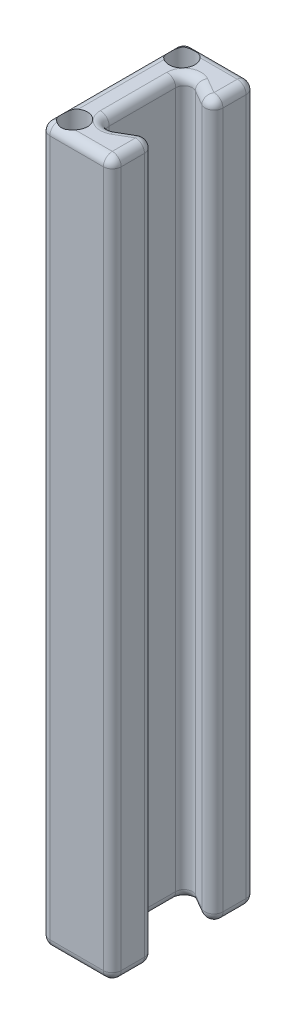
from build123d import *
from OCP.BRepFilletAPI import BRepFilletAPI_MakeFillet

# Parameters (mm, degrees)
BOSS_EXTRUDE2_DEPTH = 127
FILLET1_R1          = 1.5875
FILLET1_R2          = 1.4732
SKETCH2_R           = 2.286
CUT_EXTRUDE1_DEPTH  = 76.2
FILLET3_R           = 1.778


with BuildPart() as part:
    # Sketch1 → Boss-Extrude2 (new body)
    with BuildSketch(Plane(origin=(0, 0, 0), x_dir=(1, 0, 0), z_dir=(0, 1, 0))):
        Polygon((-28.067579909, 0), (-28.067579909, -25.4), (-15.367579909, -25.4), (-15.367579909, -16.933333333), (-22.699928279, -21.166666582), (-22.699928279, -4.233333249), (-15.367579909, -8.466666667), (-15.367579909, 0), align=None)
    extrude(amount=BOSS_EXTRUDE2_DEPTH)

    # Fillet1: one fillet with a radius per group of edges: ONE call of the kernel's fillet builder (fillet() takes one radius for all edges)
    fillet1_edges_1 = [part.edges().sort_by_distance(p)[0] for p in [
        (-19.033754094, 127, 6.349999958),
        (-22.699928279, 127, 12.699999915),
        (-19.033754094, 127, 19.049999958),
        (-15.367579909, 127, 21.166666667),
        (-15.367579909, 127, 4.233333333),
        (-21.717579909, 127, 0),
        (-28.067579909, 63.5, 0),
        (-15.367579909, 63.5, 0),
        (-21.717579909, 0, 0),
        (-15.367579909, 0, 4.233333333),
        (-15.367579909, 63.5, 8.466666667),
        (-15.367579909, 63.5, 16.933333333),
        (-15.367579909, 0, 21.166666667),
        (-15.367579909, 63.5, 25.4),
        (-22.699928279, 0, 12.699999915),
        (-28.067579909, 127, 12.7),
        (-21.717579909, 127, 25.4),
        (-28.067579909, 63.5, 25.4),
        (-28.067579909, 0, 12.7),
        (-21.717579909, 0, 25.4),
        (-19.033754094, 0, 6.349999958),
        (-19.033754094, 0, 19.049999958),
    ]]
    fillet1_edges_2 = [part.edges().sort_by_distance(p)[0] for p in [
        (-22.699928279, 63.5, 4.233333249),
        (-22.699928279, 63.5, 21.166666582),
    ]]
    fillet1 = BRepFilletAPI_MakeFillet(part.part.solid().wrapped)
    for e in fillet1_edges_1:
        fillet1.Add(FILLET1_R1, e.wrapped)
    for e in fillet1_edges_2:
        fillet1.Add(FILLET1_R2, e.wrapped)
    add(Compound.cast(fillet1.Shape()), mode=Mode.REPLACE)

    # Sketch2 → Cut-Extrude1 (cut)
    with BuildSketch(Plane(origin=(0, 127, 0), x_dir=(1, 0, 0), z_dir=(0, 1, 0))):
        with Locations((-25.235504788, -3.154170131)):
            Circle(SKETCH2_R)
        with Locations((-25.235504788, -22.245829751)):
            Circle(SKETCH2_R)
    extrude(amount=-CUT_EXTRUDE1_DEPTH, mode=Mode.SUBTRACT)

    # Fillet3
    fillet3_edges = [part.edges().sort_by_distance(p)[0] for p in [
        (-27.521504788, 50.8, 3.154170131),
        (-27.521504788, 50.8, 22.245829751),
    ]]
    fillet(fillet3_edges, radius=FILLET3_R)


solid = part.part
